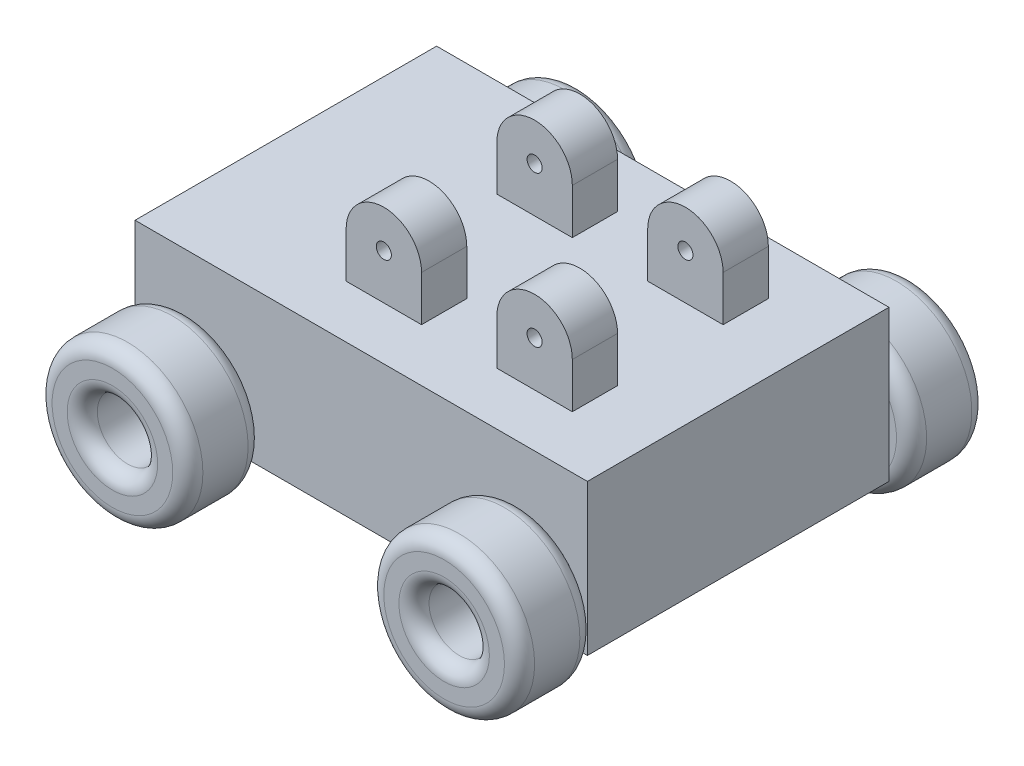
from build123d import *

# Parameters (mm, degrees)
SKETCH3_W                = 300
SKETCH3_H                = 200
BOSS_EXTRUDE1_DEPTH      = 100
CUT_EXTRUDE1_START       = -200
SKETCH4_R                = 20
CUT_EXTRUDE1_DEPTH       = 200
BOSS_EXTRUDE2_DEPTH      = 120
BOSS_EXTRUDE2_DEPTH_BACK = 120
SKETCH6_R                = 20
SKETCH7_W                = 50
SKETCH7_H                = 30
BOSS_EXTRUDE3_DEPTH      = 30
SKETCH9_R                = 25
BOSS_EXTRUDE6_DEPTH      = 30
SKETCH11_R               = 5
CUT_EXTRUDE2_DEPTH       = 186
BOSS_EXTRUDE7_START      = -15
SKETCH13_R               = 50
BOSS_EXTRUDE7_DEPTH      = 50
SKETCH14_R               = 20
CUT_EXTRUDE3_DEPTH       = 35
FILLET3_R                = 10
FILLET4_R                = 10
FILLET3_OF_MIRROR4_R     = 10
FILLET4_OF_MIRROR4_R     = 10
SKETCH18_W               = 50
SKETCH18_H               = 30
BOSS_EXTRUDE10_DEPTH     = 30
SKETCH19_R               = 25
BOSS_EXTRUDE11_DEPTH     = 30
BOSS_EXTRUDE12_START     = -30
SKETCH20_R               = 25
BOSS_EXTRUDE12_DEPTH     = 30
CUT_EXTRUDE4_DEPTH       = 15
CUT_EXTRUDE4_DEPTH_BACK  = 145
SKETCH22_R               = 5


with BuildPart() as part:
    # Sketch3 → Boss-Extrude1 (new body)
    with BuildSketch(Plane(origin=(0, 0, 0), x_dir=(1, 0, 0), z_dir=(0, 1, 0))):
        Rectangle(SKETCH3_W, SKETCH3_H)
    extrude(amount=BOSS_EXTRUDE1_DEPTH)

    # Sketch4 → Cut-Extrude1 (cut)
    with BuildSketch(Plane.XY.offset(100).offset(CUT_EXTRUDE1_START)):
        with Locations((-110, 22.5)):
            Circle(SKETCH4_R)
        with Locations((110, 22.5)):
            Circle(SKETCH4_R)
    extrude(amount=CUT_EXTRUDE1_DEPTH, mode=Mode.SUBTRACT)

    # Sketch6 → Boss-Extrude2 (add, two sides: drawn at the far end of the back side and taken through both)
    with BuildSketch(Plane.XY.offset(-BOSS_EXTRUDE2_DEPTH_BACK)):
        with Locations(Location((-110, 22.5, 0), (0, 0, 180))):
            Circle(SKETCH6_R)
        with Locations(Location((110, 22.5, 0), (0, 0, 180))):
            Circle(SKETCH6_R)
    extrude(amount=BOSS_EXTRUDE2_DEPTH + BOSS_EXTRUDE2_DEPTH_BACK)

    # Sketch7 → Boss-Extrude3 (add)
    with BuildSketch(Plane(origin=(0, 100, 0), x_dir=(1, 0, 0), z_dir=(0, 1, 0))):
        with Locations((-20, -50)):
            Rectangle(SKETCH7_W, SKETCH7_H)
        with Locations((-20, 50)):
            Rectangle(SKETCH7_W, SKETCH7_H)
    extrude(amount=BOSS_EXTRUDE3_DEPTH)

    # Sketch9 → Boss-Extrude6 (add)
    with BuildSketch(Plane.XY.offset(65)):
        with Locations((-20, 130)):
            Circle(SKETCH9_R)
    boss_extrude6 = extrude(amount=-BOSS_EXTRUDE6_DEPTH)

    # Mirror1: Boss-Extrude6 across plane
    add(boss_extrude6.mirror(Plane.XY))

    # Sketch11 → Cut-Extrude2 (cut)
    with BuildSketch(Plane.XY.offset(65)):
        with Locations((-20, 130)):
            Circle(SKETCH11_R)
    cut_extrude2 = extrude(amount=-CUT_EXTRUDE2_DEPTH, mode=Mode.SUBTRACT)

    # Sketch13 → Boss-Extrude7 (add)
    with BuildSketch(Plane.XY.offset(120).offset(BOSS_EXTRUDE7_START)):
        with Locations((-110, 22.5)):
            Circle(SKETCH13_R)
        with Locations((110, 22.5)):
            Circle(SKETCH13_R)
    boss_extrude7 = extrude(amount=BOSS_EXTRUDE7_DEPTH)

    # Sketch14 → Cut-Extrude3 (cut)
    with BuildSketch(Plane.XY.offset(155)):
        with Locations((-110, 22.5)):
            Circle(SKETCH14_R)
        with Locations((110, 22.5)):
            Circle(SKETCH14_R)
    cut_extrude3 = extrude(amount=-CUT_EXTRUDE3_DEPTH, mode=Mode.SUBTRACT)

    # Fillet3
    fillet3_edges = [part.edges().sort_by_distance(p)[0] for p in [
        (-160, 22.5, 105),
        (-160, 22.5, 155),
        (60, 22.5, 105),
        (60, 22.5, 155),
        (90, 22.5, 155),
    ]]
    fillet(fillet3_edges, radius=FILLET3_R)

    # Fillet4
    fillet4_edges = [part.edges().sort_by_distance(p)[0] for p in [
        (-130, 22.5, 155),
    ]]
    fillet(fillet4_edges, radius=FILLET4_R)

    # Mirror4: Cut-Extrude2, Boss-Extrude7, Cut-Extrude3 across plane
    add(cut_extrude2.mirror(Plane.XY), mode=Mode.SUBTRACT)
    add(boss_extrude7.mirror(Plane.XY))
    add(cut_extrude3.mirror(Plane.XY), mode=Mode.SUBTRACT)

    # Fillet3 of Mirror4
    fillet3_of_mirror4_edges = [part.edges().sort_by_distance(p)[0] for p in [
        (-160, 22.5, -105),
        (-160, 22.5, -155),
        (60, 22.5, -105),
        (60, 22.5, -155),
        (90, 22.5, -155),
    ]]
    fillet(fillet3_of_mirror4_edges, radius=FILLET3_OF_MIRROR4_R)

    # Fillet4 of Mirror4
    fillet4_of_mirror4_edges = [part.edges().sort_by_distance(p)[0] for p in [
        (-130, 22.5, -155),
    ]]
    fillet(fillet4_of_mirror4_edges, radius=FILLET4_OF_MIRROR4_R)

    # Sketch18 → Boss-Extrude10 (add)
    with BuildSketch(Plane(origin=(0, 100, 0), x_dir=(1, 0, 0), z_dir=(0, 1, 0))):
        with Locations((80, 50)):
            Rectangle(SKETCH18_W, SKETCH18_H)
        with Locations((80, -50)):
            Rectangle(SKETCH18_W, SKETCH18_H)
    extrude(amount=BOSS_EXTRUDE10_DEPTH)

    # Sketch19 → Boss-Extrude11 (add)
    with BuildSketch(Plane.XY.offset(65)):
        with Locations((80, 130)):
            Circle(SKETCH19_R)
    extrude(amount=-BOSS_EXTRUDE11_DEPTH)

    # Sketch20 → Boss-Extrude12 (add)
    with BuildSketch(Plane(origin=(0, 0, -65), x_dir=(-1, 0, 0), z_dir=(0, 0, -1)).offset(BOSS_EXTRUDE12_START)):
        with Locations((-80, 130)):
            Circle(SKETCH20_R)
    extrude(amount=BOSS_EXTRUDE12_DEPTH)

    # Sketch22 → Cut-Extrude4 (cut, two sides: drawn at the far end of the back side and taken through both)
    with BuildSketch(Plane.XY.offset(65).offset(-CUT_EXTRUDE4_DEPTH_BACK)):
        with Locations(Location((80, 130, 0), (0, 0, 180))):
            Circle(SKETCH22_R)
    extrude(amount=CUT_EXTRUDE4_DEPTH + CUT_EXTRUDE4_DEPTH_BACK, mode=Mode.SUBTRACT)


solid = part.part
